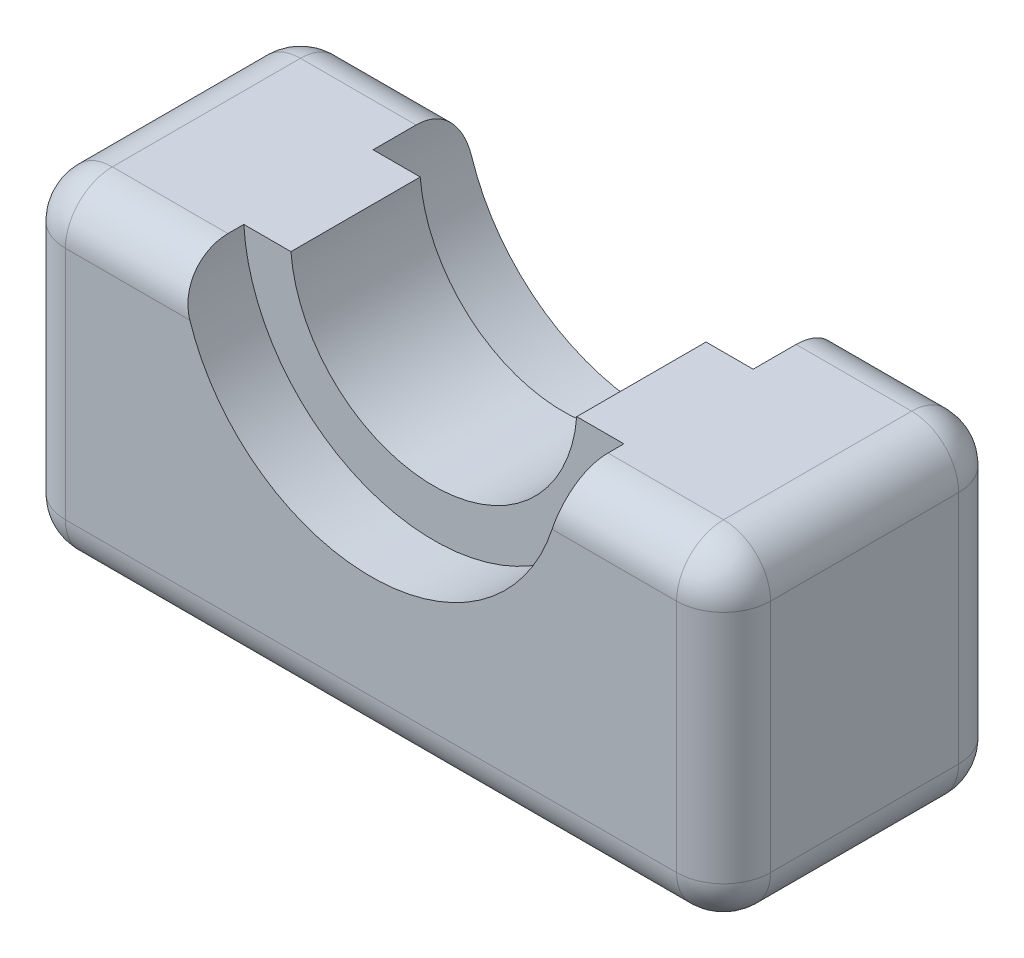
from build123d import *

# Parameters (mm, degrees)
SKETCH_1_W      = 30
SKETCH_1_H      = 14
EXTRUDE_1_DEPTH = 12
FILLET_1_R      = 2


with BuildPart() as part:
    # Эскиз1 → Бобышка-Вытянуть1 (new body)
    with BuildSketch(Plane.XY):
        Rectangle(SKETCH_1_W, SKETCH_1_H)
    extrude(amount=EXTRUDE_1_DEPTH)

    # Эскиз2 → Вырез-Повернуть1 (revolve, cut)
    with BuildSketch(Plane(origin=(0, 7.5, 0), x_dir=(1, 0, 0), z_dir=(0, 1, 0))):
        Polygon((0, 0), (0, -12), (8.1, -12), (8.1, -9.325), (6.1, -9.325), (6.1, -3.825), (8.1, -3.825), (8.1, 0), align=None)
    revolve(axis=Axis((0, 7.5, -4.413755415), (0, 0, 1)), mode=Mode.SUBTRACT)

    # Скругление1
    fillet_1_edges = [part.edges().sort_by_distance(p)[0] for p in [
        (-15, 0, 12),
        (0, -7, 12),
        (-11.542276586, 7, 0),
        (-11.542276586, 7, 12),
        (15, 0, 12),
        (0, -7, 0),
        (-15, 0, 0),
        (11.542276586, 7, 0),
        (15, 0, 0),
        (11.542276586, 7, 12),
        (15, -7, 6),
        (-15, -7, 6),
        (-15, 7, 6),
        (15, 7, 6),
    ]]
    fillet(fillet_1_edges, radius=FILLET_1_R)


solid = part.part
